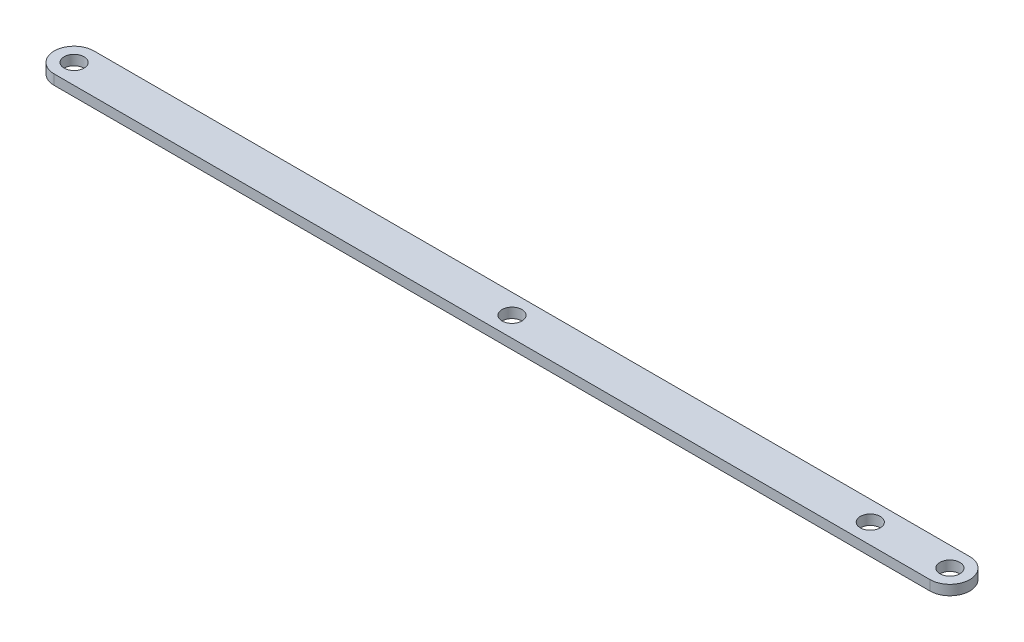
from build123d import *

# Parameters (mm, degrees)
SKETCH1_R           = 5
BOSS_EXTRUDE1_DEPTH = 5
SKETCH3_R           = 5
CUT_EXTRUDE1_DEPTH  = 10


with BuildPart() as part:
    # Sketch1 → Boss-Extrude1 (new body)
    with BuildSketch(Plane(origin=(0, 0, 0), x_dir=(1, 0, 0), z_dir=(0, 1, 0))):
        with BuildLine():
            Line((-72.346809709, 10), (367.653190291, 10))
            ThreePointArc((367.653190291, 10), (377.653190291, 0), (367.653190291, -10))
            Line((367.653190291, -10), (-72.346809709, -10))
            ThreePointArc((-72.346809709, -10), (-82.346809709, 0), (-72.346809709, 10))
        make_face()
        with Locations(Location((-72.346809709, 0, 0), (0, 0, 270))):
            Circle(SKETCH1_R, mode=Mode.SUBTRACT)
        with Locations(Location((367.653190291, 0, 0), (0, 0, 270))):
            Circle(SKETCH1_R, mode=Mode.SUBTRACT)
    extrude(amount=BOSS_EXTRUDE1_DEPTH)

    # Sketch3 → Cut-Extrude1 (cut)
    with BuildSketch(Plane(origin=(0, 5, 0), x_dir=(1, 0, 0), z_dir=(0, 1, 0))):
        with Locations(Location((327.653190291, 0, 0), (0, 0, 270))):
            Circle(SKETCH3_R)
        with Locations(Location((147.653190291, 0, 0), (0, 0, 270))):
            Circle(SKETCH3_R)
    extrude(amount=-CUT_EXTRUDE1_DEPTH, mode=Mode.SUBTRACT)


solid = part.part
